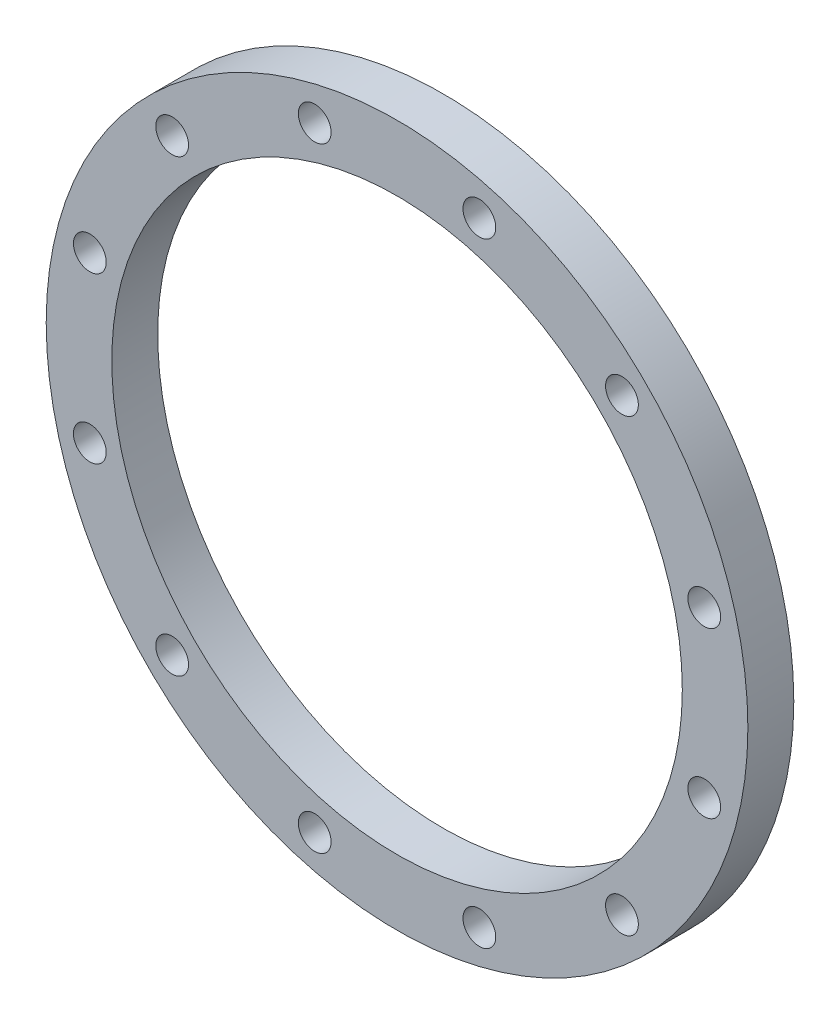
from build123d import *

# Parameters (mm, degrees)
SKETCH1_R               = 535
SKETCH1_R_2             = 435
BOSS_EXTRUDE1_DEPTH     = 70
CUT_EXTRUDE2_DEPTH      = 760.835508515
CUT_EXTRUDE2_DEPTH_BACK = 760.835508515
SKETCH3_R               = 25


with BuildPart() as part:
    # Sketch1 → Boss-Extrude1 (new body)
    with BuildSketch(Plane.XY):
        Circle(SKETCH1_R)
        Circle(SKETCH1_R_2, mode=Mode.SUBTRACT)
    extrude(amount=BOSS_EXTRUDE1_DEPTH)

    # Sketch3 → Cut-Extrude2 (cut, two sides: drawn at the far end of the back side and taken through both)
    with BuildSketch(Plane.XY.offset(70).offset(-CUT_EXTRUDE2_DEPTH_BACK)):
        with Locations((125.527236875, 468.47402575)):
            Circle(SKETCH3_R)
        with Locations((342.946788875, 342.946788875)):
            Circle(SKETCH3_R)
        with Locations((468.47402575, 125.527236875)):
            Circle(SKETCH3_R)
        with Locations((468.47402575, -125.527236875)):
            Circle(SKETCH3_R)
        with Locations((342.946788875, -342.946788876)):
            Circle(SKETCH3_R)
        with Locations((125.527236875, -468.47402575)):
            Circle(SKETCH3_R)
        with Locations((-125.527236875, -468.47402575)):
            Circle(SKETCH3_R)
        with Locations((-342.946788876, -342.946788875)):
            Circle(SKETCH3_R)
        with Locations((-468.47402575, -125.527236875)):
            Circle(SKETCH3_R)
        with Locations((-468.47402575, 125.527236875)):
            Circle(SKETCH3_R)
        with Locations((-342.946788875, 342.946788876)):
            Circle(SKETCH3_R)
        with Locations((-125.527236875, 468.47402575)):
            Circle(SKETCH3_R)
    extrude(amount=CUT_EXTRUDE2_DEPTH + CUT_EXTRUDE2_DEPTH_BACK, mode=Mode.SUBTRACT)


solid = part.part
